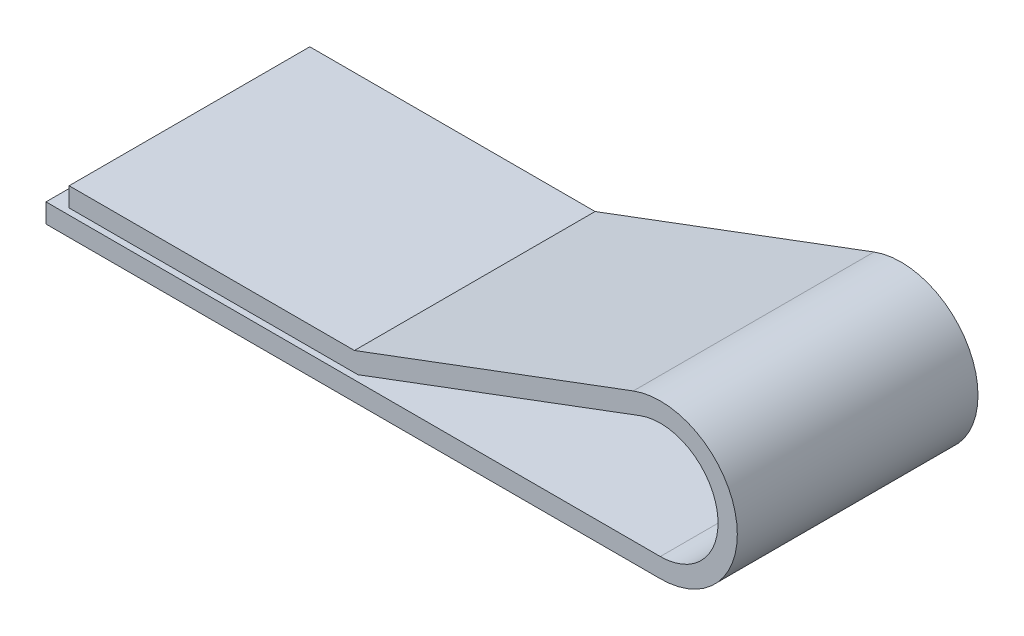
from build123d import *

# Parameters (mm, degrees)
EXTRUDE_THIN1_DEPTH = 12.5


with BuildPart() as part:
    # Sketch1 → Extrude-Thin1 (new, symmetric)
    with BuildSketch(Plane.XY):
        with BuildLine():
            Line((-63.809554967, 0), (0, 0))
            ThreePointArc((0, 0), (5.904048089, 7.068745133), (-2.103307553, 11.61926128))
            Line((-2.103307553, 11.61926128), (-31.409124045, 0.65))
            Line((-31.409124045, 0.65), (-61.409124045, 0.65))
            Line((-61.409124045, 0.65), (-61.409124045, 2.65))
            Line((-61.409124045, 2.65), (-31.77116213, 2.65))
            Line((-31.77116213, 2.65), (-2.804410071, 13.492348374))
            ThreePointArc((-2.804410071, 13.492348374), (7.872064119, 7.424993511), (0, -2))
            Line((0, -2), (-63.809554967, -2))
            Line((-63.809554967, -2), (-63.809554967, 0))
        make_face()
    extrude(amount=EXTRUDE_THIN1_DEPTH, both=True)


solid = part.part
